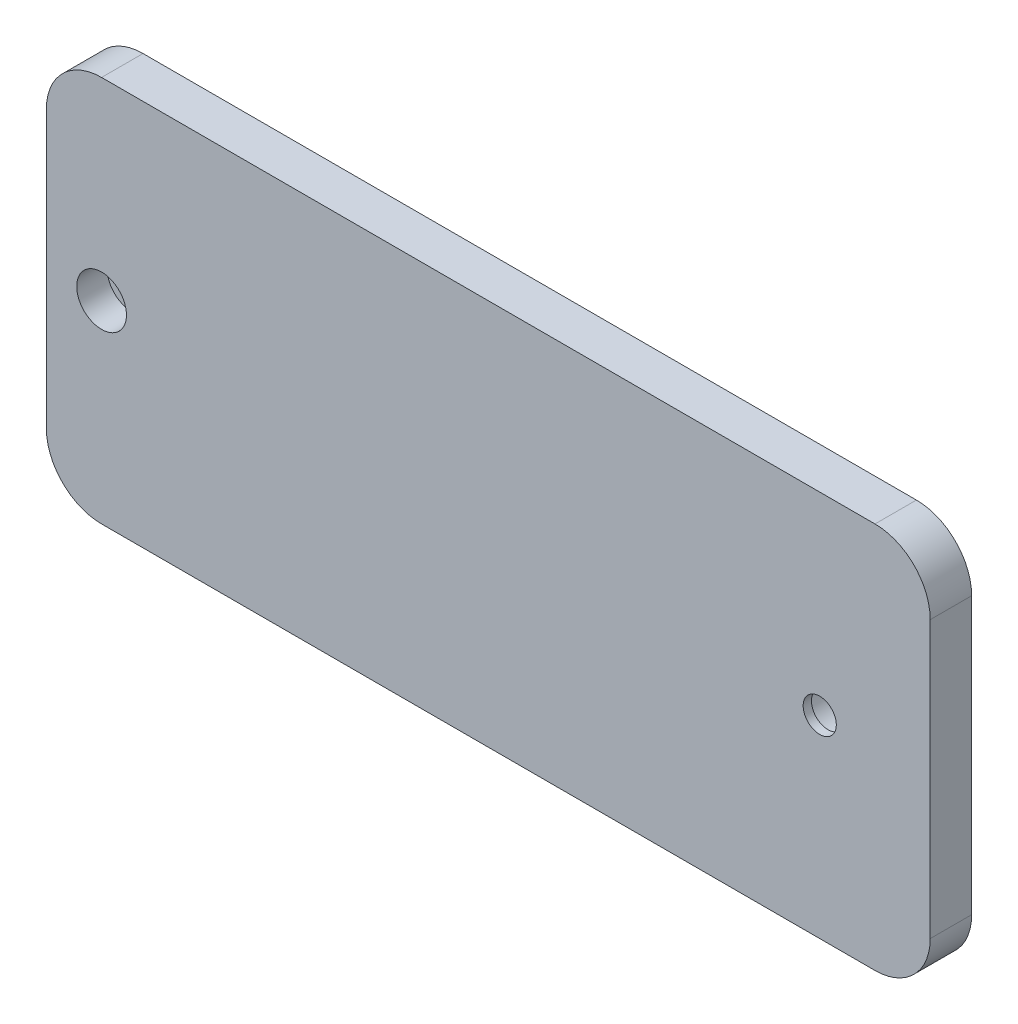
from build123d import *

# Parameters (mm, degrees)
SKETCH1_W               = 160
SKETCH1_H               = 70
BOSS_EXTRUDE1_DEPTH     = 7.5
CUT_EXTRUDE1_DEPTH      = 88.642740715
CUT_EXTRUDE1_DEPTH_BACK = 88.642740715
SKETCH2_R               = 2.5
SKETCH2_R_2             = 3
SKETCH3_R               = 4.5
CUT_EXTRUDE2_DEPTH      = 5.5
SKETCH4_R               = 5
CUT_EXTRUDE3_DEPTH      = 6
SKETCH5_W               = 95
SKETCH5_H               = 5
BOSS_EXTRUDE2_DEPTH     = 2.3
BOSS_EXTRUDE3_DEPTH     = 95
FILLET1_R               = 1
FILLET2_R               = 0.5
FILLET3_R               = 10


with BuildPart() as part:
    # Sketch1 → Boss-Extrude1 (new body)
    with BuildSketch(Plane.XY):
        Rectangle(SKETCH1_W, SKETCH1_H)
    extrude(amount=BOSS_EXTRUDE1_DEPTH)

    # Sketch2 → Cut-Extrude1 (cut, two sides: drawn at the far end of the back side and taken through both)
    with BuildSketch(Plane.XY.offset(7.5).offset(-CUT_EXTRUDE1_DEPTH_BACK)):
        with Locations((-70, 0)):
            Circle(SKETCH2_R)
        with Locations((60, 0)):
            Circle(SKETCH2_R_2)
    extrude(amount=CUT_EXTRUDE1_DEPTH + CUT_EXTRUDE1_DEPTH_BACK, mode=Mode.SUBTRACT)

    # Sketch3 → Cut-Extrude2 (cut)
    with BuildSketch(Plane.XY.offset(7.5)):
        with Locations((-70, 0)):
            Circle(SKETCH3_R)
    extrude(amount=-CUT_EXTRUDE2_DEPTH, mode=Mode.SUBTRACT)

    # Sketch4 → Cut-Extrude3 (cut)
    with BuildSketch(Plane(origin=(0, 0, 0), x_dir=(-1, 0, 0), z_dir=(0, 0, -1))):
        with Locations((-60, 0)):
            Circle(SKETCH4_R)
    extrude(amount=-CUT_EXTRUDE3_DEPTH, mode=Mode.SUBTRACT)

    # Sketch5 → Boss-Extrude2 (add)
    with BuildSketch(Plane(origin=(0, 0, 0), x_dir=(-1, 0, 0), z_dir=(0, 0, -1))):
        with Locations((12.5, 0)):
            Rectangle(SKETCH5_W, SKETCH5_H)
    extrude(amount=BOSS_EXTRUDE2_DEPTH)

    # Sketch6 → Boss-Extrude3 (add)
    with BuildSketch(Plane(origin=(35, 0, 0), x_dir=(0, 0, -1), z_dir=(1, 0, 0))):
        Polygon((2.3, 6), (2.3, -6), (6.6, -2.5), (6.6, 2.5), align=None)
    extrude(amount=-BOSS_EXTRUDE3_DEPTH)

    # Fillet1
    fillet1_edges = [part.edges().sort_by_distance(p)[0] for p in [
        (-12.5, -2.5, -6.6),
        (-12.5, 2.5, -6.6),
    ]]
    fillet(fillet1_edges, radius=FILLET1_R)

    # Fillet2
    fillet2_edges = [part.edges().sort_by_distance(p)[0] for p in [
        (-12.5, -6, -2.3),
        (-12.5, 6, -2.3),
    ]]
    fillet(fillet2_edges, radius=FILLET2_R)

    # Fillet3
    fillet3_edges = [part.edges().sort_by_distance(p)[0] for p in [
        (-80, 35, 3.75),
        (80, 35, 3.75),
        (80, -35, 3.75),
        (-80, -35, 3.75),
    ]]
    fillet(fillet3_edges, radius=FILLET3_R)


solid = part.part
